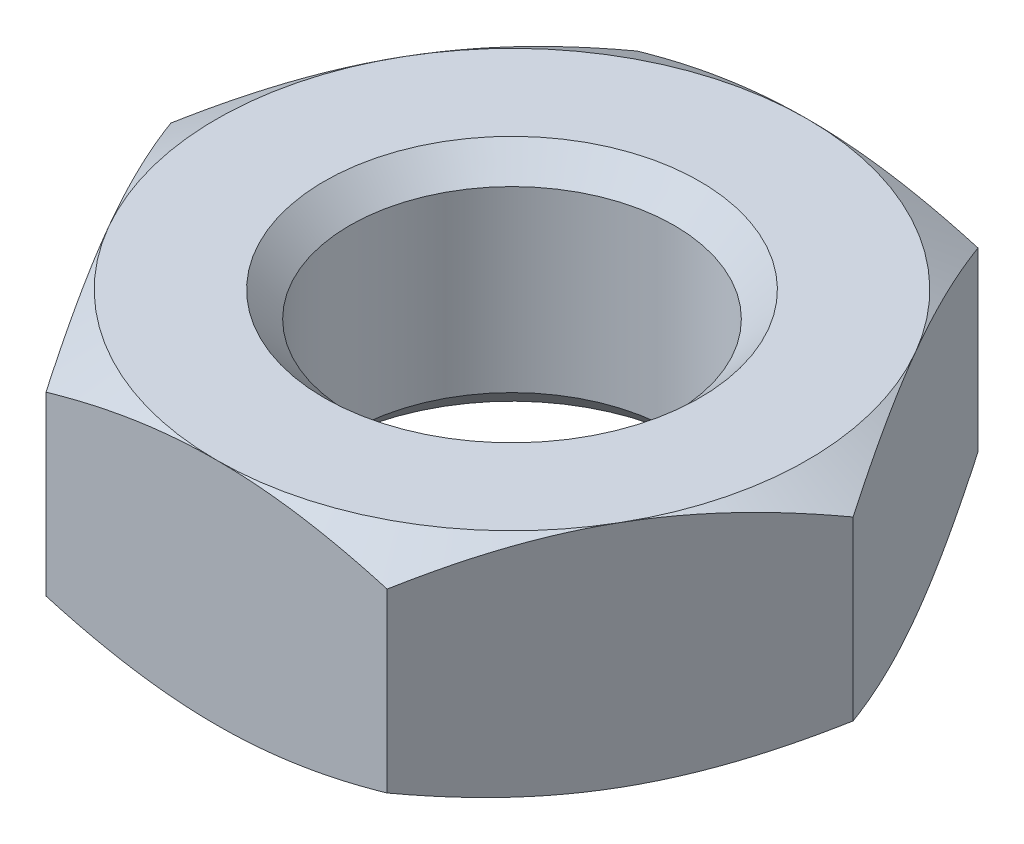
from build123d import *

# Parameters (mm, degrees)
BOSS_EXTRUDE1_DEPTH     = 2.475
SKETCH2_OUTSIDE_W       = 37.888
SKETCH2_OUTSIDE_H       = 35.916
SKETCH2_OUTSIDE_R       = 6.375
CUT_EXTRUDE1_DEPTH      = 4.95
CUT_EXTRUDE1_DRAFT      = -60
MIRROR1_COPY_1_SKETCH_W = 37.888
MIRROR1_COPY_1_SKETCH_H = 35.916
MIRROR1_COPY_1_SKETCH_R = 6.375
MIRROR1_COPY_1_DEPTH    = 4.95
MIRROR1_COPY_1_DRAFT    = -60


with BuildPart() as part:
    # Sketch1 → Boss-Extrude1 (new, symmetric)
    with BuildSketch(Plane(origin=(0, 0, 0), x_dir=(1, 0, 0), z_dir=(0, 1, 0))):
        Polygon((3.680607966, -6.375), (7.361215932, 0), (3.680607966, 6.375), (-3.680607966, 6.375), (-7.361215932, 0), (-3.680607966, -6.375), align=None)
    extrude(amount=BOSS_EXTRUDE1_DEPTH, both=True)


with BuildPart() as cut_extrude1_tool:
    # Sketch2 outside → Cut-Extrude1 (with draft: the straight prism first)
    with BuildSketch(Plane(origin=(0, 2.475, 0), x_dir=(1, 0, 0), z_dir=(0, 1, 0))):
        Rectangle(SKETCH2_OUTSIDE_W, SKETCH2_OUTSIDE_H)
        Circle(SKETCH2_OUTSIDE_R, mode=Mode.SUBTRACT)
    extrude(amount=-CUT_EXTRUDE1_DEPTH)
    # Cut-Extrude1: the draft: its side faces are tilted about the plane it starts from
    cut_extrude1_sides = [cut_extrude1_tool.faces().sort_by_distance(p)[0] for p in [
        (0, 0, 17.958),
        (18.944, 0, 0),
        (0, 0, -17.958),
        (-18.944, 0, 0),
        (-6.375, 0, 0),
    ]]
    draft(cut_extrude1_sides, Plane(origin=(0, 2.475, 0), x_dir=(1, 0, 0), z_dir=(0, 1, 0)), CUT_EXTRUDE1_DRAFT)


with BuildPart() as part_1:
    add(part.part)

    # Cut-Extrude1: cut by cut_extrude1_tool
    add(cut_extrude1_tool.part, mode=Mode.SUBTRACT)


with BuildPart() as mirror1_copy_1_tool:
    # Mirror1 copy 1 sketch → Mirror1 copy 1 (with draft: the straight prism first)
    with BuildSketch(Plane.XZ.offset(2.475)):
        Rectangle(MIRROR1_COPY_1_SKETCH_W, MIRROR1_COPY_1_SKETCH_H)
        Circle(MIRROR1_COPY_1_SKETCH_R, mode=Mode.SUBTRACT)
    extrude(amount=-MIRROR1_COPY_1_DEPTH)
    # Mirror1 copy 1: the draft: its side faces are tilted about the plane it starts from
    mirror1_copy_1_sides = [mirror1_copy_1_tool.faces().sort_by_distance(p)[0] for p in [
        (0, 0, 17.958),
        (18.944, 0, 0),
        (0, 0, -17.958),
        (-18.944, 0, 0),
        (-6.375, 0, 0),
    ]]
    draft(mirror1_copy_1_sides, Plane.XZ.offset(2.475), MIRROR1_COPY_1_DRAFT)


with BuildPart() as part_2:
    add(part_1.part)

    # Mirror1 copy 1: cut by mirror1_copy_1_tool
    add(mirror1_copy_1_tool.part, mode=Mode.SUBTRACT)

    # Sketch5 → M8x1.0 Tapped Hole1 (revolve, cut)
    with BuildSketch(Plane(origin=(0, 2.475, 0), x_dir=(0, 0, 1), z_dir=(1, 0, 0))):
        Polygon((0, 0), (0, 4.95), (4.05, 4.95), (3.5, 4.4), (3.5, 0.55), (4.05, 0), align=None)
    revolve(axis=Axis((0, 8.825, 0), (0, -1, 0)), mode=Mode.SUBTRACT)


solid = part_2.part
